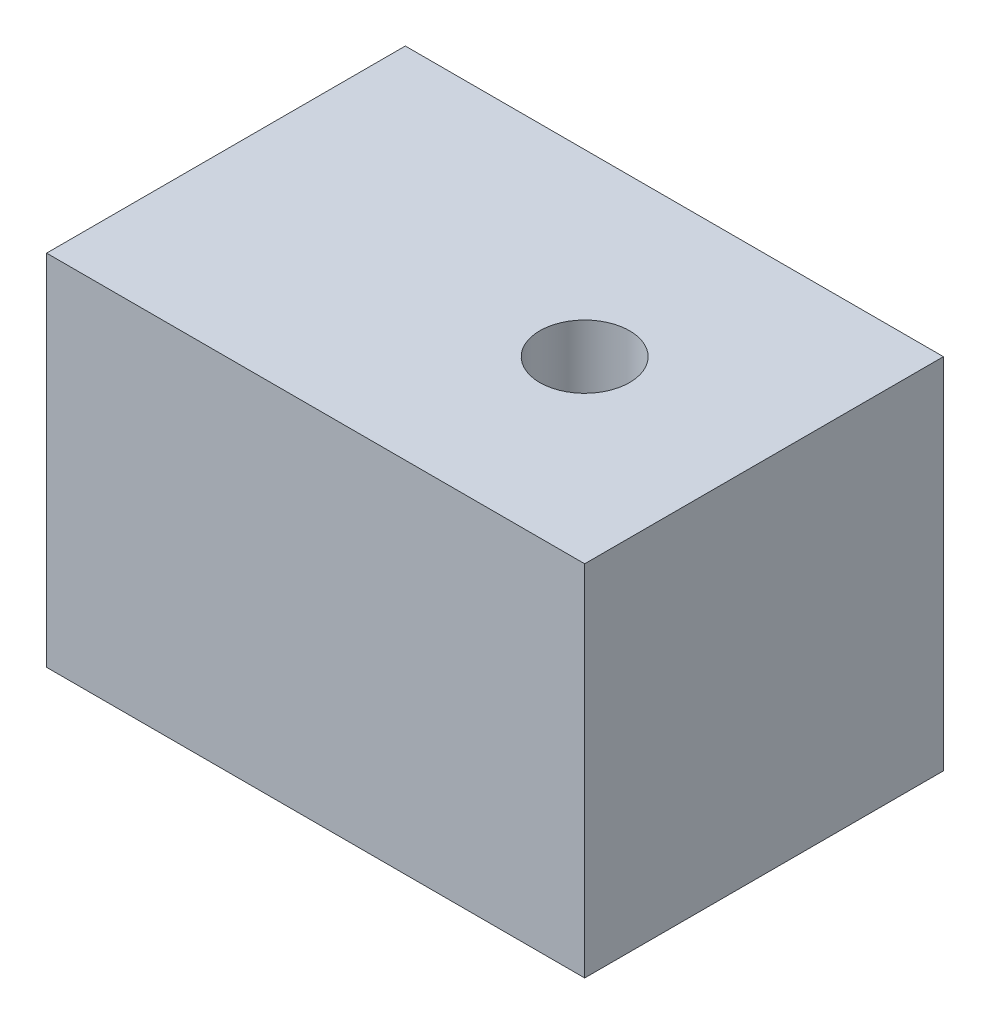
from build123d import *

# Parameters (mm, degrees)
SKETCH1_W                   = 38.1
SKETCH1_H                   = 25.4
BOSS_EXTRUDE1_DEPTH         = 25.4
SKETCH3_R                   = 1.5875
CUT_EXTRUDE2_DEPTH          = 25.4
F_1_4_28_TAPPED_HOLE1_D     = 5.4102
F_1_4_28_TAPPED_HOLE1_DEPTH = 17.23
F_1_4_28_TAPPED_HOLE1_TIP   = 1.625388061
SKETCH2_R                   = 3.18
CUT_EXTRUDE6_DEPTH          = 15.875
SKETCH8_R                   = 1.5875
CUT_EXTRUDE7_DEPTH          = 35.1957966


with BuildPart() as part:
    # Sketch1 → Boss-Extrude1 (new body)
    with BuildSketch(Plane(origin=(0, 0, 0), x_dir=(1, 0, 0), z_dir=(0, 1, 0))):
        Rectangle(SKETCH1_W, SKETCH1_H)
    extrude(amount=BOSS_EXTRUDE1_DEPTH)

    # Sketch3 → Cut-Extrude2 (cut)
    with BuildSketch(Plane.ZY.offset(19.05)):
        with Locations((0, 12.7)):
            Circle(SKETCH3_R)
    extrude(amount=-CUT_EXTRUDE2_DEPTH, mode=Mode.SUBTRACT)

    # 1/4-28 Tapped Hole1
    with Locations(Plane.ZY.offset(19.05)):
        with Locations((0, 12.7)):
            Hole(F_1_4_28_TAPPED_HOLE1_D / 2, depth=F_1_4_28_TAPPED_HOLE1_DEPTH)
            with Locations((0, 0, -(F_1_4_28_TAPPED_HOLE1_DEPTH + F_1_4_28_TAPPED_HOLE1_TIP / 2))):  # 118° drill point
                Cone(0, F_1_4_28_TAPPED_HOLE1_D / 2, F_1_4_28_TAPPED_HOLE1_TIP, mode=Mode.SUBTRACT)

    # Sketch2 → Cut-Extrude6 (cut)
    with BuildSketch(Plane(origin=(0, 25.4, 0), x_dir=(1, 0, 0), z_dir=(0, 1, 0))):
        with Locations(Location((6.35, 0, 0), (0, 0, 270))):
            Circle(SKETCH2_R)
    extrude(amount=-CUT_EXTRUDE6_DEPTH, mode=Mode.SUBTRACT)

    # Sketch8 → Cut-Extrude7 (cut, through all)
    with BuildSketch(Plane.XZ):
        with Locations(Location((6.35, 0, 0), (0, 0, 270))):
            Circle(SKETCH8_R)
    extrude(amount=-CUT_EXTRUDE7_DEPTH, mode=Mode.SUBTRACT)


solid = part.part
